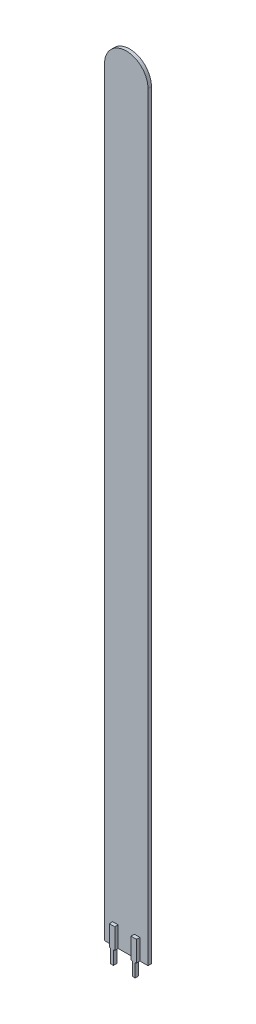
from build123d import *

# Parameters (mm, degrees)
RESSALTO_EXTRUS_O1_DEPTH = 0.25
RESSALTO_EXTRUS_O2_DEPTH = 0.5


with BuildPart() as part:
    # Esboço3 → Ressalto-extrusão1 (new, symmetric)
    with BuildSketch(Plane.XY):
        with BuildLine():
            Line((3.175, -57.15), (-3.175, -57.15))
            Line((-3.175, -57.15), (-3.175, 53.975))
            ThreePointArc((-3.175, 53.975), (0, 57.15), (3.175, 53.975))
            Line((3.175, 53.975), (3.175, -57.15))
        make_face()
    extrude(amount=RESSALTO_EXTRUS_O1_DEPTH, both=True)

    # Esboço4 → Ressalto-extrusão2 (add)
    with BuildSketch(Plane.XY.offset(0.25)):
        Polygon((-1.1875, -54.15), (-1.9875, -54.15), (-1.9875, -57.15), (-1.9375, -57.15), (-1.2375, -57.15), (-1.1875, -57.15), align=None)
        with BuildLine():
            Line((-1.2375, -57.15), (-1.9375, -57.15))
            ThreePointArc((-1.9375, -57.15), (-1.831433983, -57.193933983), (-1.7875, -57.3))
            Line((-1.7875, -57.3), (-1.7875, -59.15))
            Line((-1.7875, -59.15), (-1.3875, -59.15))
            Line((-1.3875, -59.15), (-1.3875, -57.3))
            ThreePointArc((-1.3875, -57.3), (-1.343566017, -57.193933983), (-1.2375, -57.15))
        make_face()
    ressalto_extrus_o2 = extrude(amount=RESSALTO_EXTRUS_O2_DEPTH)

    # Espelhar2: Ressalto-extrusão2 across plane
    add(ressalto_extrus_o2.mirror(Plane(origin=(0, 0, 0), x_dir=(0, 0, 1), z_dir=(1, 0, 0))))


solid = part.part
